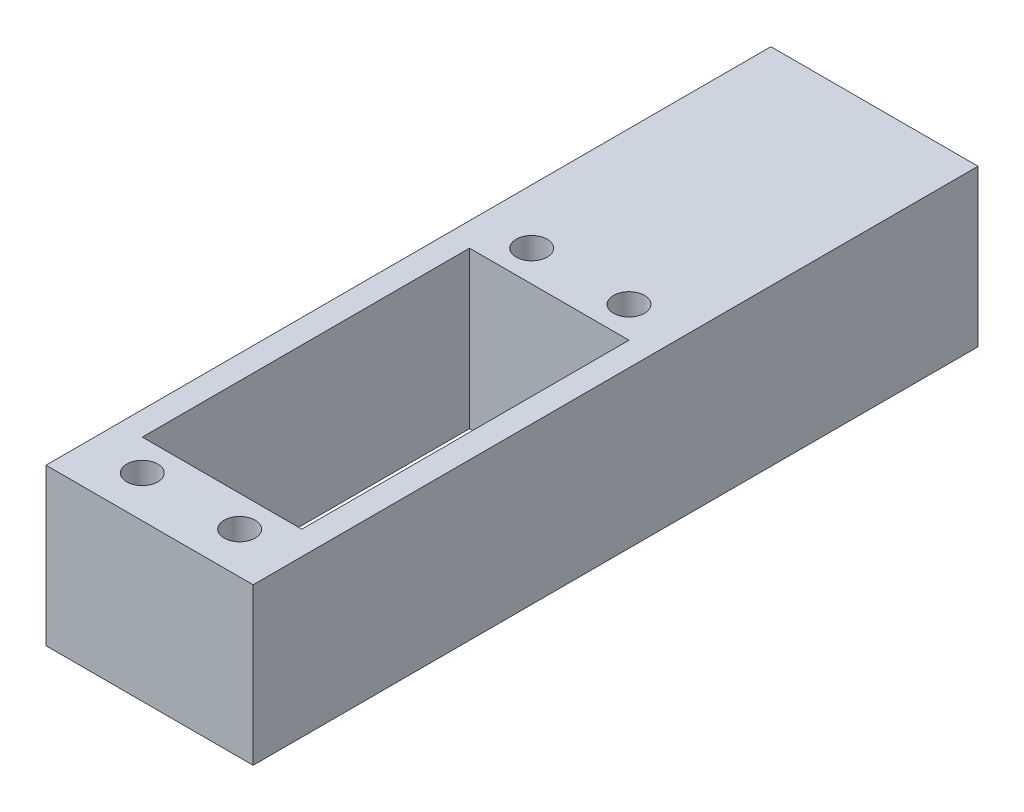
from build123d import *

# Parameters (mm, degrees)
SKETCH1_W           = 25.4
SKETCH1_H           = 88.9
SKETCH1_R           = 1.905
SKETCH1_W_2         = 19.558
SKETCH1_H_2         = 40.132
BOSS_EXTRUDE1_DEPTH = 19.177


with BuildPart() as part:
    # Sketch1 → Boss-Extrude1 (new body)
    with BuildSketch(Plane(origin=(0, 0, 0), x_dir=(1, 0, 0), z_dir=(0, 1, 0))):
        with Locations((12.7, 44.45)):
            Rectangle(SKETCH1_W, SKETCH1_H)
        with Locations(Location((6.731, 52.832, 0), (0, 0, 90))):
            Circle(SKETCH1_R, mode=Mode.SUBTRACT)
        with Locations(Location((18.669, 52.832, 0), (0, 0, 90))):
            Circle(SKETCH1_R, mode=Mode.SUBTRACT)
        with Locations(Location((6.731, 5.08, 0), (0, 0, 90))):
            Circle(SKETCH1_R, mode=Mode.SUBTRACT)
        with Locations(Location((18.669, 5.08, 0), (0, 0, 90))):
            Circle(SKETCH1_R, mode=Mode.SUBTRACT)
        with Locations((12.7, 28.956)):
            Rectangle(SKETCH1_W_2, SKETCH1_H_2, mode=Mode.SUBTRACT)
    extrude(amount=BOSS_EXTRUDE1_DEPTH)


solid = part.part
